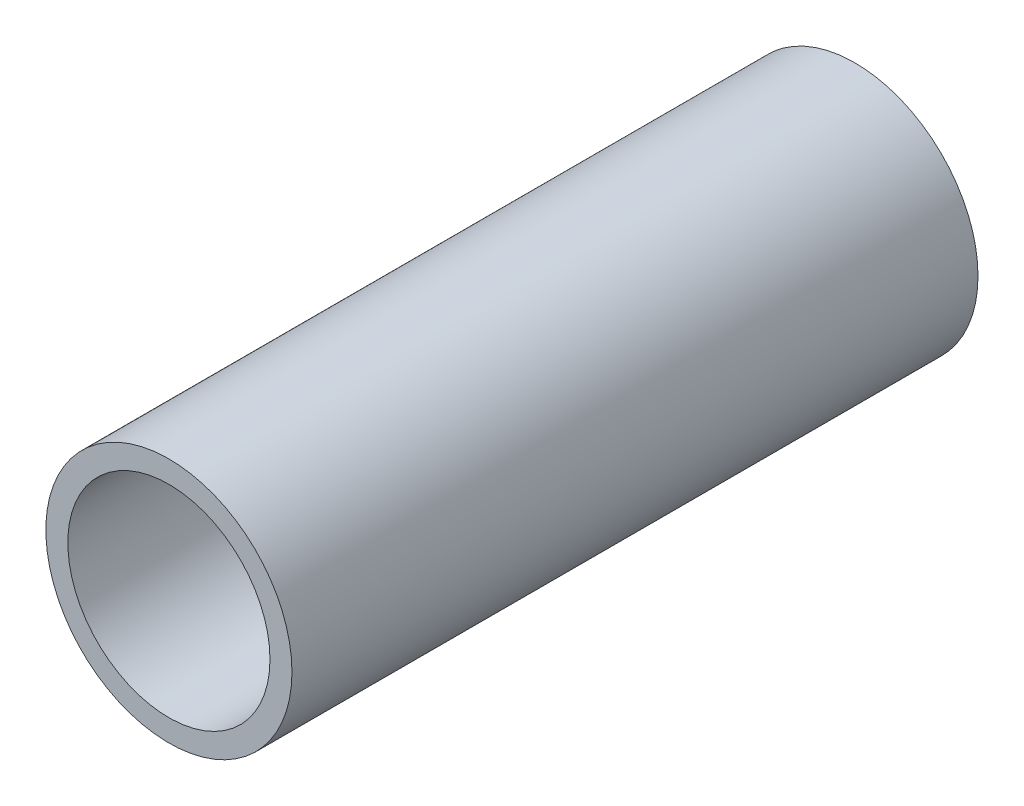
from build123d import *

# Parameters (mm, degrees)
SKETCH_1_R      = 5.6
SKETCH_1_R_2    = 4.6
EXTRUDE_1_DEPTH = 31.22


with BuildPart() as part:
    # 스케치1 → 보스-돌출1 (new body)
    with BuildSketch(Plane.XY):
        Circle(SKETCH_1_R)
        Circle(SKETCH_1_R_2, mode=Mode.SUBTRACT)
    extrude(amount=EXTRUDE_1_DEPTH)


solid = part.part
